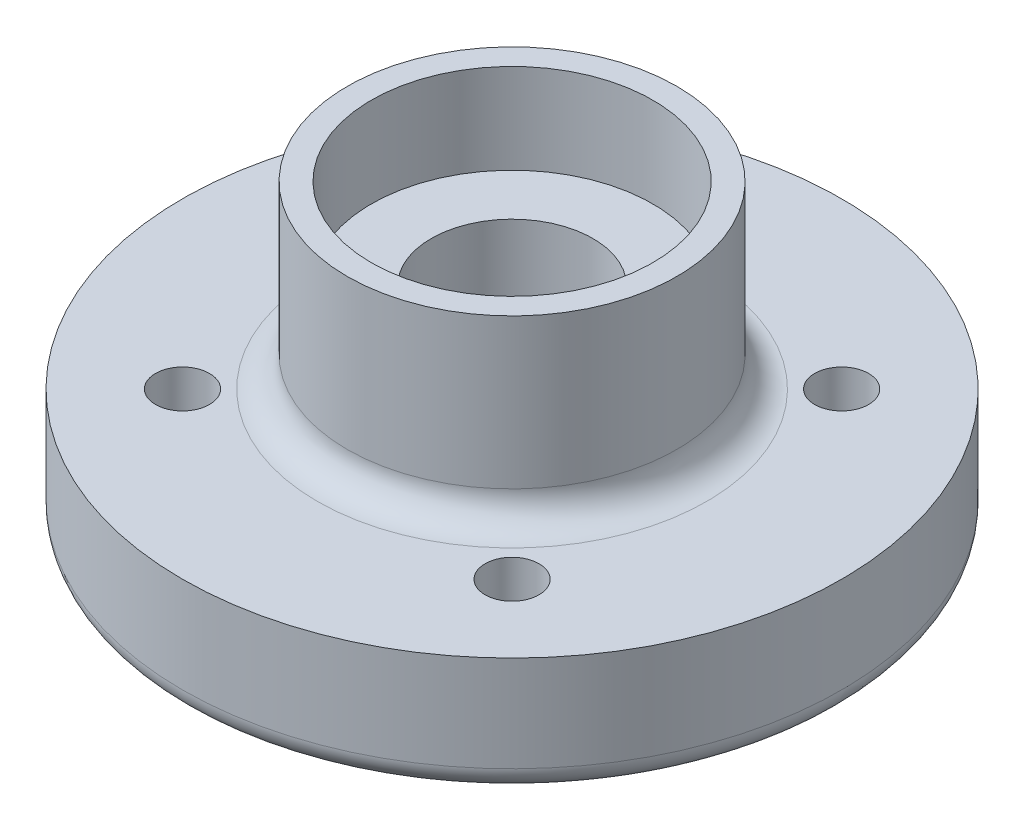
from build123d import *

# Parameters (mm, degrees)
SKETCH1_R                               = 55
BOSS_EXTRUDE1_DEPTH                     = 20
SKETCH2_R                               = 27.5
BOSS_EXTRUDE2_DEPTH                     = 30
SKETCH6_R                               = 23.5
CUT_EXTRUDE1_DEPTH                      = 15
FILLET1_R                               = 5
CBORE_FOR_M8_HEX_HEAD_BOLT1_D           = 9
CBORE_FOR_M8_HEX_HEAD_BOLT1_CBORE_D     = 18.011
CBORE_FOR_M8_HEX_HEAD_BOLT1_CBORE_DEPTH = 5.3
FILLET2_R                               = 4
SKETCH10_R                              = 13.5
CUT_EXTRUDE2_DEPTH                      = 53
SKETCH11_R                              = 22.5
SKETCH11_R_2                            = 13.5
BOSS_EXTRUDE3_DEPTH                     = 15
FILLET3_R                               = 5


with BuildPart() as part:
    # Sketch1 → Boss-Extrude1 (new body)
    with BuildSketch(Plane(origin=(0, 0, 0), x_dir=(1, 0, 0), z_dir=(0, 1, 0))):
        with Locations(Location((0, 0, 0), (0, 0, 270))):
            Circle(SKETCH1_R)
    extrude(amount=BOSS_EXTRUDE1_DEPTH)

    # Sketch2 → Boss-Extrude2 (add)
    with BuildSketch(Plane(origin=(0, 20, 0), x_dir=(1, 0, 0), z_dir=(0, 1, 0))):
        with Locations(Location((0, 0, 0), (0, 0, 270))):
            Circle(SKETCH2_R)
    extrude(amount=BOSS_EXTRUDE2_DEPTH)

    # Sketch6 → Cut-Extrude1 (cut)
    with BuildSketch(Plane(origin=(0, 50, 0), x_dir=(1, 0, 0), z_dir=(0, 1, 0))):
        with Locations(Location((0, 0, 0), (0, 0, 270))):
            Circle(SKETCH6_R)
    extrude(amount=-CUT_EXTRUDE1_DEPTH, mode=Mode.SUBTRACT)

    # Fillet1
    fillet1_edges = [part.edges().sort_by_distance(p)[0] for p in [
        (0, 20, -27.5),
    ]]
    fillet(fillet1_edges, radius=FILLET1_R)

    # CBORE for M8 Hex Head Bolt1 (through all)
    with Locations(Plane(origin=(-27.5, 0, 27.5), x_dir=(0, 0, -1), z_dir=(0, -1, 0))):
        with Locations((0, 0), (0, 55), (55, 55), (55, 0)):
            CounterBoreHole(CBORE_FOR_M8_HEX_HEAD_BOLT1_D / 2, CBORE_FOR_M8_HEX_HEAD_BOLT1_CBORE_D / 2, CBORE_FOR_M8_HEX_HEAD_BOLT1_CBORE_DEPTH)

    # Fillet2
    fillet2_edges = [part.edges().sort_by_distance(p)[0] for p in [
        (0, 0, -55),
    ]]
    fillet(fillet2_edges, radius=FILLET2_R)

    # Sketch10 → Cut-Extrude2 (cut)
    with BuildSketch(Plane(origin=(0, 35, 0), x_dir=(1, 0, 0), z_dir=(0, 1, 0))):
        with Locations(Location((0, 0, 0), (0, 0, 270))):
            Circle(SKETCH10_R)
    extrude(amount=-CUT_EXTRUDE2_DEPTH, mode=Mode.SUBTRACT)

    # Sketch11 → Boss-Extrude3 (add)
    with BuildSketch(Plane.XZ):
        with Locations(Location((0, 0, 0), (0, 0, 90))):
            Circle(SKETCH11_R)
        with Locations(Location((0, 0, 0), (0, 0, 90))):
            Circle(SKETCH11_R_2, mode=Mode.SUBTRACT)
    extrude(amount=BOSS_EXTRUDE3_DEPTH)

    # Fillet3
    fillet3_edges = [part.edges().sort_by_distance(p)[0] for p in [
        (0, 0, -22.5),
        (0, -15, -22.5),
    ]]
    fillet(fillet3_edges, radius=FILLET3_R)


solid = part.part
